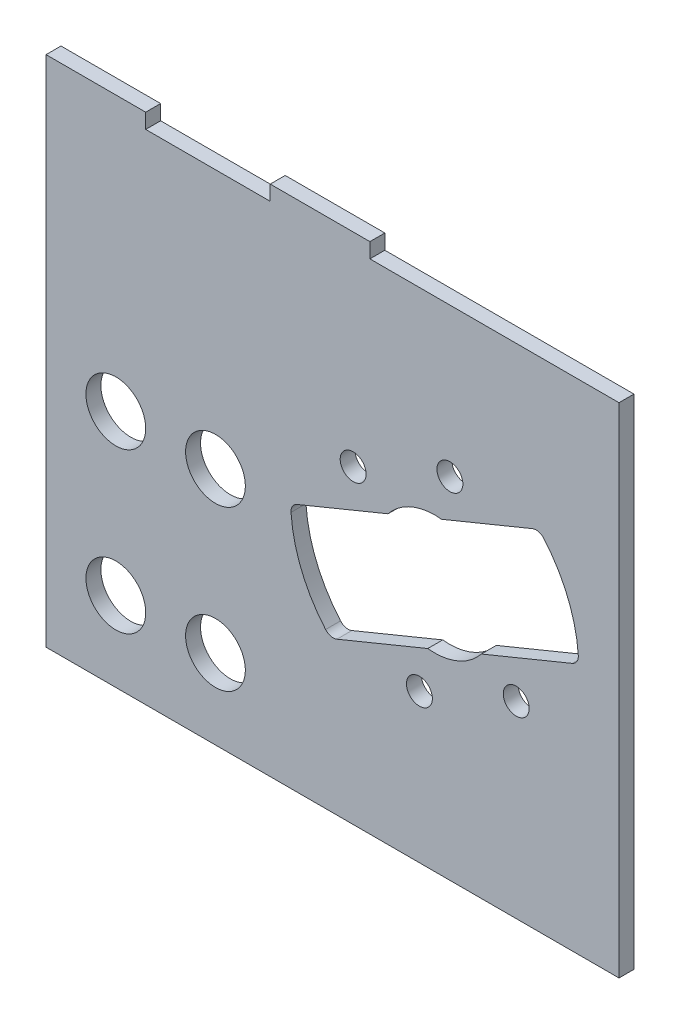
from build123d import *

# Parameters (mm, degrees)
SKETCH1_W           = 115
SKETCH1_H           = 100
SKETCH1_W_2         = 20
SKETCH1_H_2         = 3
BOSS_EXTRUDE1_DEPTH = 3
SKETCH2_R           = 6
CUT_EXTRUDE1_DEPTH  = 3
SKETCH3_R           = 2.6
CUT_EXTRUDE2_DEPTH  = 10


with BuildPart() as part:
    # Sketch1 → Boss-Extrude1 (new body)
    with BuildSketch(Plane.XY):
        with Locations((1, 0)):
            Rectangle(SKETCH1_W, SKETCH1_H)
        with Locations((-1.5, 51.5)):
            Rectangle(SKETCH1_W_2, SKETCH1_H_2)
        with Locations((-46.5, 51.5)):
            Rectangle(SKETCH1_W_2, SKETCH1_H_2)
    extrude(amount=BOSS_EXTRUDE1_DEPTH)

    # Sketch2 → Cut-Extrude1 (cut)
    with BuildSketch(Plane.XY.offset(3)):
        with Locations((-42.496090888, -34)):
            Circle(SKETCH2_R)
        with Locations((-42.496090888, -2)):
            Circle(SKETCH2_R)
        with Locations((-22.496090888, -34)):
            Circle(SKETCH2_R)
        with Locations((-22.496090888, -2)):
            Circle(SKETCH2_R)
    extrude(amount=-CUT_EXTRUDE1_DEPTH, mode=Mode.SUBTRACT)

    # Sketch3 → Cut-Extrude2 (cut)
    with BuildSketch(Plane.XY.offset(3)):
        with Locations((24.560133375, 20.17760104)):
            Circle(SKETCH3_R)
        with Locations((37.863702859, -12.19545935)):
            Circle(SKETCH3_R)
        with BuildLine():
            Line((1.884861427, -19.412788021), (20.117628398, -11.920111105))
            ThreePointArc((20.117628398, -11.920111105), (26.061223823, -11.099334991), (30.864513292, -7.503725129))
            Line((30.864513292, -7.503725129), (49.097066309, -0.010527574))
            ThreePointArc((49.097066309, -0.010527574), (50.035092062, 0.783146292), (50.33183638, 1.975519274))
            ThreePointArc((50.33183638, 1.975519274), (48.230377797, 10.984733419), (43.389811543, 18.868323086))
            ThreePointArc((43.389811543, 18.868323086), (42.334905798, 19.508804913), (41.104917855, 19.407944809))
            Line((41.104917855, 19.407944809), (22.86955388, 11.921590589))
            ThreePointArc((22.86955388, 11.921590589), (16.932809638, 11.096881192), (12.135486708, 7.503725129))
            Line((12.135486708, 7.503725129), (-6.097280263, 0.011048213))
            ThreePointArc((-6.097280263, 0.011048213), (-7.035570092, -0.78284909), (-7.33239795, -1.975557752))
            ThreePointArc((-7.33239795, -1.975557752), (-5.230898436, -10.984947373), (-0.3902379, -18.868690592))
            ThreePointArc((-0.3902379, -18.868690592), (0.659469027, -19.508046594), (1.884861427, -19.412788021))
        make_face()
        with Locations((18.439866625, -20.17760104)):
            Circle(SKETCH3_R)
        with Locations((5.136297141, 12.19545935)):
            Circle(SKETCH3_R)
    extrude(amount=-CUT_EXTRUDE2_DEPTH, mode=Mode.SUBTRACT)


solid = part.part
